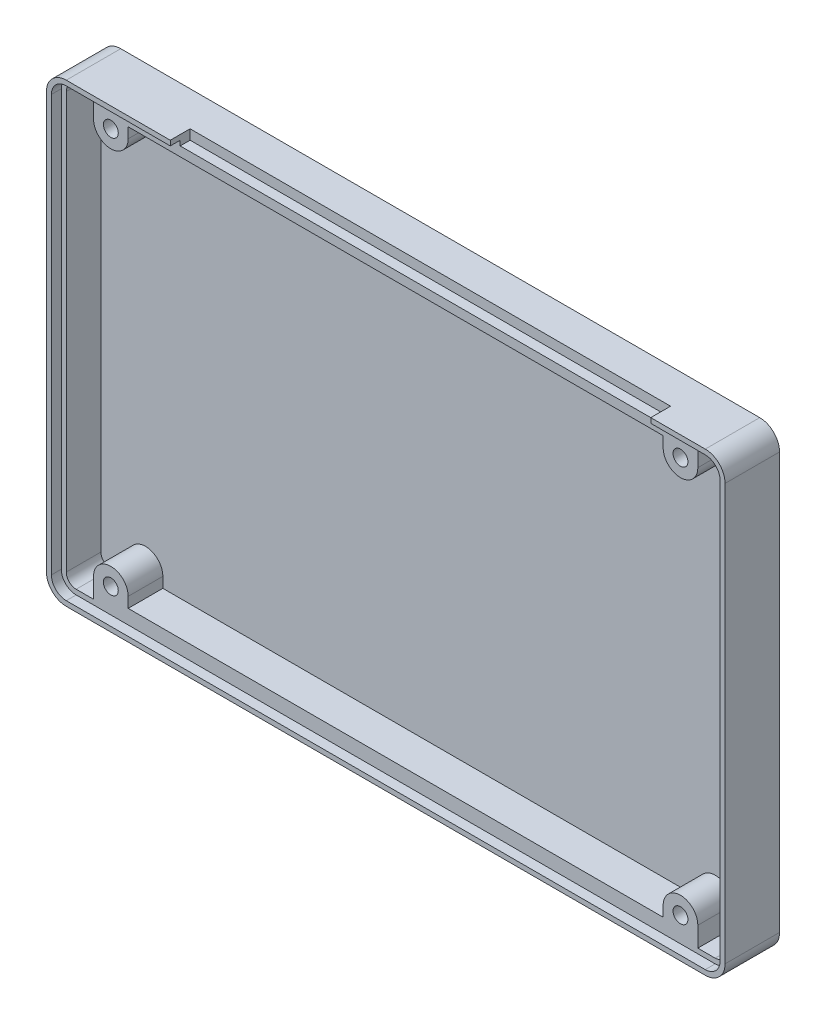
from build123d import *

# Parameters (mm, degrees)
SKETCH1_W           = 137
SKETCH1_H           = 92
BOSS_EXTRUDE1_DEPTH = 2
SKETCH2_W           = 137
SKETCH2_H           = 92
SKETCH2_W_2         = 133
SKETCH2_H_2         = 88
BOSS_EXTRUDE2_DEPTH = 7
SKETCH3_W           = 137
SKETCH3_H           = 92
SKETCH3_W_2         = 135
SKETCH3_H_2         = 90
BOSS_EXTRUDE3_DEPTH = 2
SKETCH4_R           = 1.5
BOSS_EXTRUDE4_DEPTH = 7
SKETCH8_W           = 108
SKETCH8_H           = 1.9
BOSS_EXTRUDE6_DEPTH = 7
FILLET1_R           = 2
FILLET2_R           = 3
FILLET3_R           = 4
SKETCH11_W          = 108
SKETCH11_H          = 1.9
BOSS_EXTRUDE7_DEPTH = 7
SKETCH12_W          = 97
SKETCH12_H          = 4
CUT_EXTRUDE3_DEPTH  = 2
CUT_EXTRUDE4_START  = -10
SKETCH13_R          = 1.5
CUT_EXTRUDE4_DEPTH  = 10


with BuildPart() as part:
    # Sketch1 → Boss-Extrude1 (new body)
    with BuildSketch(Plane.XY):
        with Locations((68.5, 46)):
            Rectangle(SKETCH1_W, SKETCH1_H)
    extrude(amount=BOSS_EXTRUDE1_DEPTH)

    # Sketch2 → Boss-Extrude2 (add)
    with BuildSketch(Plane.XY.offset(2)):
        with Locations((68.5, 46)):
            Rectangle(SKETCH2_W, SKETCH2_H)
        with Locations((68.5, 46)):
            Rectangle(SKETCH2_W_2, SKETCH2_H_2, mode=Mode.SUBTRACT)
    extrude(amount=BOSS_EXTRUDE2_DEPTH)

    # Sketch3 → Boss-Extrude3 (add)
    with BuildSketch(Plane.XY.offset(9)):
        with Locations((68.5, 46)):
            Rectangle(SKETCH3_W, SKETCH3_H)
        with Locations((68.5, 46)):
            Rectangle(SKETCH3_W_2, SKETCH3_H_2, mode=Mode.SUBTRACT)
    extrude(amount=BOSS_EXTRUDE3_DEPTH)

    # Sketch4 → Boss-Extrude4 (add)
    # profile 1 of 4: a face of its own
    with BuildSketch(Plane.XY.offset(2)):
        with BuildLine():
            Line((7.5, 6), (7.5, 2))
            Line((7.5, 2), (14.5, 2))
            Line((14.5, 2), (14.5, 6))
            ThreePointArc((14.5, 6), (11, 9.5), (7.5, 6))
        make_face()
        with Locations((11, 6)):
            Circle(SKETCH4_R, mode=Mode.SUBTRACT)
    # profile 2 of 4: a face of its own
    with BuildSketch(Plane.XY.offset(2)):
        with BuildLine():
            Line((122.5, 6), (122.5, 2))
            Line((122.5, 2), (129.5, 2))
            Line((129.5, 2), (129.5, 6))
            ThreePointArc((129.5, 6), (126, 9.5), (122.5, 6))
        make_face()
        with Locations((126, 6)):
            Circle(SKETCH4_R, mode=Mode.SUBTRACT)
    # profile 3 of 4: a face of its own
    with BuildSketch(Plane.XY.offset(2)):
        with BuildLine():
            Line((129.5, 86), (129.5, 90))
            Line((129.5, 90), (122.5, 90))
            Line((122.5, 90), (122.5, 86))
            ThreePointArc((122.5, 86), (126, 82.5), (129.5, 86))
        make_face()
        with Locations((126, 86)):
            Circle(SKETCH4_R, mode=Mode.SUBTRACT)
    # profile 4 of 4: a face of its own
    with BuildSketch(Plane.XY.offset(2)):
        with BuildLine():
            Line((14.5, 86), (14.5, 90))
            Line((14.5, 90), (7.5, 90))
            Line((7.5, 90), (7.5, 86))
            ThreePointArc((7.5, 86), (11, 82.5), (14.5, 86))
        make_face()
        with Locations((11, 86)):
            Circle(SKETCH4_R, mode=Mode.SUBTRACT)
    extrude(amount=BOSS_EXTRUDE4_DEPTH)

    # Sketch8 → Boss-Extrude6 (add)
    with BuildSketch(Plane.XY.offset(2)):
        with Locations((68.5, 2.95)):
            Rectangle(SKETCH8_W, SKETCH8_H)
    extrude(amount=BOSS_EXTRUDE6_DEPTH)

    # Fillet1
    fillet1_edges = [part.edges().sort_by_distance(p)[0] for p in [
        (2, 2, 5.5),
        (135, 2, 5.5),
        (135, 90, 5.5),
        (2, 90, 5.5),
    ]]
    fillet(fillet1_edges, radius=FILLET1_R)

    # Fillet2
    fillet2_edges = [part.edges().sort_by_distance(p)[0] for p in [
        (1, 1, 10),
        (136, 1, 10),
        (136, 91, 10),
        (1, 91, 10),
    ]]
    fillet(fillet2_edges, radius=FILLET2_R)

    # Fillet3
    fillet3_edges = [part.edges().sort_by_distance(p)[0] for p in [
        (0, 92, 5.5),
        (137, 92, 5.5),
        (137, 0, 5.5),
        (0, 0, 5.5),
    ]]
    fillet(fillet3_edges, radius=FILLET3_R)

    # Sketch11 → Boss-Extrude7 (add)
    with BuildSketch(Plane.XY.offset(2)):
        with Locations((68.5, 89.05)):
            Rectangle(SKETCH11_W, SKETCH11_H)
    extrude(amount=BOSS_EXTRUDE7_DEPTH)

    # Sketch12 → Cut-Extrude3 (cut)
    with BuildSketch(Plane(origin=(0, 92, 0), x_dir=(1, 0, 0), z_dir=(0, 1, 0))):
        with Locations((73.5, -9)):
            Rectangle(SKETCH12_W, SKETCH12_H)
    extrude(amount=-CUT_EXTRUDE3_DEPTH, mode=Mode.SUBTRACT)

    # Sketch13 → Cut-Extrude4 (cut)
    with BuildSketch(Plane.XY.offset(9).offset(CUT_EXTRUDE4_START)):
        with Locations(Location((11, 86, 0), (0, 0, 180))):
            Circle(SKETCH13_R)
        with Locations(Location((11, 6, 0), (0, 0, 180))):
            Circle(SKETCH13_R)
        with Locations(Location((126, 6, 0), (0, 0, 180))):
            Circle(SKETCH13_R)
        with Locations(Location((126, 86, 0), (0, 0, 180))):
            Circle(SKETCH13_R)
    extrude(amount=CUT_EXTRUDE4_DEPTH, mode=Mode.SUBTRACT)


solid = part.part
